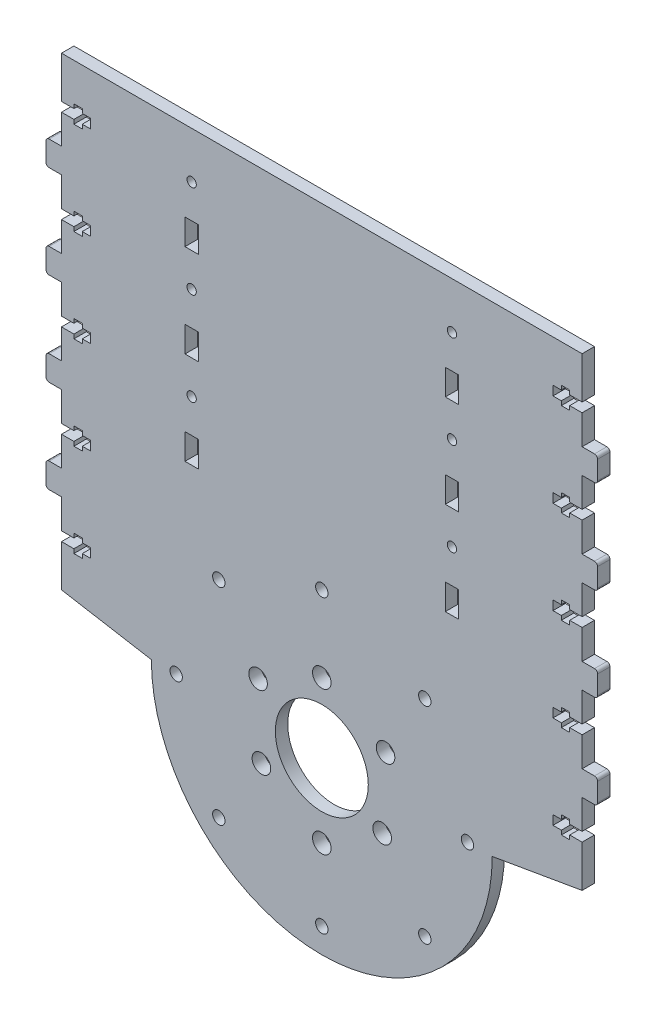
from build123d import *

# Parameters (mm, degrees)
SKETCH_1_R      = 1.5
SKETCH_1_R_2    = 3
SKETCH_1_R_3    = 15
SKETCH_1_R_4    = 2
SKETCH_1_W      = 4.3
SKETCH_1_H      = 8.3
EXTRUDE_1_DEPTH = 4
FILLET_1_R      = 1


with BuildPart() as part:
    # 草图1 → 凸台-拉伸1 (new body)
    with BuildSketch(Plane.XY):
        with BuildLine():
            Line((154.4, 46.5), (154.4, 49.5))
            Line((154.4, 49.5), (151.7, 49.5))
            Line((151.7, 49.5), (151.7, 50.85))
            Line((151.7, 50.85), (149, 50.85))
            Line((149, 50.85), (149, 49.5))
            Line((149, 49.5), (145, 49.5))
            Line((145, 49.5), (145, 59))
            Line((145, 59), (140, 59))
            Line((140, 59), (140, 67))
            Line((140, 67), (145, 67))
            Line((145, 67), (145, 76.5))
            Line((145, 76.5), (149, 76.5))
            Line((149, 76.5), (149, 75.15))
            Line((149, 75.15), (151.7, 75.15))
            Line((151.7, 75.15), (151.7, 76.5))
            Line((151.7, 76.5), (154.4, 76.5))
            Line((154.4, 76.5), (154.4, 79.5))
            Line((154.4, 79.5), (151.7, 79.5))
            Line((151.7, 79.5), (151.7, 80.85))
            Line((151.7, 80.85), (149, 80.85))
            Line((149, 80.85), (149, 79.5))
            Line((149, 79.5), (145, 79.5))
            Line((145, 79.5), (145, 89))
            Line((145, 89), (140, 89))
            Line((140, 89), (140, 97))
            Line((140, 97), (145, 97))
            Line((145, 97), (145, 106.5))
            Line((145, 106.5), (149, 106.5))
            Line((149, 106.5), (149, 105.15))
            Line((149, 105.15), (151.7, 105.15))
            Line((151.7, 105.15), (151.7, 106.5))
            Line((151.7, 106.5), (154.4, 106.5))
            Line((154.4, 106.5), (154.4, 109.5))
            Line((154.4, 109.5), (151.7, 109.5))
            Line((151.7, 109.5), (151.7, 110.85))
            Line((151.7, 110.85), (149, 110.85))
            Line((149, 110.85), (149, 109.5))
            Line((149, 109.5), (145, 109.5))
            Line((145, 109.5), (145, 123))
            Line((145, 123), (313, 123))
            Line((313, 123), (313, 109.5))
            Line((313, 109.5), (309, 109.5))
            Line((309, 109.5), (309, 110.85))
            Line((309, 110.85), (306.3, 110.85))
            Line((306.3, 110.85), (306.3, 109.5))
            Line((306.3, 109.5), (303.6, 109.5))
            Line((303.6, 109.5), (303.6, 106.5))
            Line((303.6, 106.5), (306.3, 106.5))
            Line((306.3, 106.5), (306.3, 105.15))
            Line((306.3, 105.15), (309, 105.15))
            Line((309, 105.15), (309, 106.5))
            Line((309, 106.5), (313, 106.5))
            Line((313, 106.5), (313, 97))
            Line((313, 97), (318, 97))
            Line((318, 97), (318, 89))
            Line((318, 89), (313, 89))
            Line((313, 89), (313, 79.5))
            Line((313, 79.5), (309, 79.5))
            Line((309, 79.5), (309, 80.85))
            Line((309, 80.85), (306.3, 80.85))
            Line((306.3, 80.85), (306.3, 79.5))
            Line((306.3, 79.5), (303.6, 79.5))
            Line((303.6, 79.5), (303.6, 76.5))
            Line((303.6, 76.5), (306.3, 76.5))
            Line((306.3, 76.5), (306.3, 75.15))
            Line((306.3, 75.15), (309, 75.15))
            Line((309, 75.15), (309, 76.5))
            Line((309, 76.5), (313, 76.5))
            Line((313, 76.5), (313, 67))
            Line((313, 67), (318, 67))
            Line((318, 67), (318, 59))
            Line((318, 59), (313, 59))
            Line((313, 59), (313, 49.5))
            Line((313, 49.5), (309, 49.5))
            Line((309, 49.5), (309, 50.85))
            Line((309, 50.85), (306.3, 50.85))
            Line((306.3, 50.85), (306.3, 49.5))
            Line((306.3, 49.5), (303.6, 49.5))
            Line((303.6, 49.5), (303.6, 46.5))
            Line((303.6, 46.5), (306.3, 46.5))
            Line((306.3, 46.5), (306.3, 45.15))
            Line((306.3, 45.15), (309, 45.15))
            Line((309, 45.15), (309, 46.5))
            Line((309, 46.5), (313, 46.5))
            Line((313, 46.5), (313, 37))
            Line((313, 37), (318, 37))
            Line((318, 37), (318, 29))
            Line((318, 29), (313, 29))
            Line((313, 29), (313, 19.5))
            Line((313, 19.5), (309, 19.5))
            Line((309, 19.5), (309, 20.85))
            Line((309, 20.85), (306.3, 20.85))
            Line((306.3, 20.85), (306.3, 19.5))
            Line((306.3, 19.5), (303.6, 19.5))
            Line((303.6, 19.5), (303.6, 16.5))
            Line((303.6, 16.5), (306.3, 16.5))
            Line((306.3, 16.5), (306.3, 15.15))
            Line((306.3, 15.15), (309, 15.15))
            Line((309, 15.15), (309, 16.5))
            Line((309, 16.5), (313, 16.5))
            Line((313, 16.5), (313, 7))
            Line((313, 7), (318, 7))
            Line((318, 7), (318, -1))
            Line((318, -1), (313, -1))
            Line((313, -1), (313, -10.5))
            Line((313, -10.5), (309, -10.5))
            Line((309, -10.5), (309, -9.15))
            Line((309, -9.15), (306.3, -9.15))
            Line((306.3, -9.15), (306.3, -10.5))
            Line((306.3, -10.5), (303.6, -10.5))
            Line((303.6, -10.5), (303.6, -13.5))
            Line((303.6, -13.5), (306.3, -13.5))
            Line((306.3, -13.5), (306.3, -14.85))
            Line((306.3, -14.85), (309, -14.85))
            Line((309, -14.85), (309, -13.5))
            Line((309, -13.5), (313, -13.5))
            Line((313, -13.5), (313, -27))
            Line((313, -27), (284, -32))
            ThreePointArc((284, -32), (229, -87), (174, -32))
            Line((174, -32), (145, -27))
            Line((145, -27), (145, -13.5))
            Line((145, -13.5), (149, -13.5))
            Line((149, -13.5), (149, -14.85))
            Line((149, -14.85), (151.7, -14.85))
            Line((151.7, -14.85), (151.7, -13.5))
            Line((151.7, -13.5), (154.4, -13.5))
            Line((154.4, -13.5), (154.4, -10.5))
            Line((154.4, -10.5), (151.7, -10.5))
            Line((151.7, -10.5), (151.7, -9.15))
            Line((151.7, -9.15), (149, -9.15))
            Line((149, -9.15), (149, -10.5))
            Line((149, -10.5), (145, -10.5))
            Line((145, -10.5), (145, -1))
            Line((145, -1), (140, -1))
            Line((140, -1), (140, 7))
            Line((140, 7), (145, 7))
            Line((145, 7), (145, 16.5))
            Line((145, 16.5), (149, 16.5))
            Line((149, 16.5), (149, 15.15))
            Line((149, 15.15), (151.7, 15.15))
            Line((151.7, 15.15), (151.7, 16.5))
            Line((151.7, 16.5), (154.4, 16.5))
            Line((154.4, 16.5), (154.4, 19.5))
            Line((154.4, 19.5), (151.7, 19.5))
            Line((151.7, 19.5), (151.7, 20.85))
            Line((151.7, 20.85), (149, 20.85))
            Line((149, 20.85), (149, 19.5))
            Line((149, 19.5), (145, 19.5))
            Line((145, 19.5), (145, 29))
            Line((145, 29), (140, 29))
            Line((140, 29), (140, 37))
            Line((140, 37), (145, 37))
            Line((145, 37), (145, 46.5))
            Line((145, 46.5), (149, 46.5))
            Line((149, 46.5), (149, 45.15))
            Line((149, 45.15), (151.7, 45.15))
            Line((151.7, 45.15), (151.7, 46.5))
            Line((151.7, 46.5), (154.4, 46.5))
        make_face()
        with Locations((187, 108)):
            Circle(SKETCH_1_R, mode=Mode.SUBTRACT)
        with Locations((229, -55.75)):
            Circle(SKETCH_1_R_2, mode=Mode.SUBTRACT)
        with Locations((248.485571585, -43.25)):
            Circle(SKETCH_1_R_2, mode=Mode.SUBTRACT)
        with Locations((229, -32)):
            Circle(SKETCH_1_R_3, mode=Mode.SUBTRACT)
        with Locations((276, -32)):
            Circle(SKETCH_1_R_4, mode=Mode.SUBTRACT)
        with Locations((208.43189666, -20.125)):
            Circle(SKETCH_1_R_2, mode=Mode.SUBTRACT)
        with Locations((249.56810334, -20.125)):
            Circle(SKETCH_1_R_2, mode=Mode.SUBTRACT)
        with Locations((209.514428415, -43.25)):
            Circle(SKETCH_1_R_2, mode=Mode.SUBTRACT)
        with Locations((229, -9.5)):
            Circle(SKETCH_1_R_2, mode=Mode.SUBTRACT)
        with Locations((187, 78)):
            Circle(SKETCH_1_R, mode=Mode.SUBTRACT)
        with Locations((187, 48)):
            Circle(SKETCH_1_R, mode=Mode.SUBTRACT)
        with Locations((271, 48)):
            Circle(SKETCH_1_R, mode=Mode.SUBTRACT)
        with Locations((271, 78)):
            Circle(SKETCH_1_R, mode=Mode.SUBTRACT)
        with Locations((271, 108)):
            Circle(SKETCH_1_R, mode=Mode.SUBTRACT)
        with Locations((262.234018716, -65.234018716)):
            Circle(SKETCH_1_R_4, mode=Mode.SUBTRACT)
        with Locations((229, -79)):
            Circle(SKETCH_1_R_4, mode=Mode.SUBTRACT)
        with Locations((195.765981284, -65.234018716)):
            Circle(SKETCH_1_R_4, mode=Mode.SUBTRACT)
        with Locations((182, -32)):
            Circle(SKETCH_1_R_4, mode=Mode.SUBTRACT)
        with Locations((195.765981284, 1.234018716)):
            Circle(SKETCH_1_R_4, mode=Mode.SUBTRACT)
        with Locations((229, 15)):
            Circle(SKETCH_1_R_4, mode=Mode.SUBTRACT)
        with Locations((262.234018716, 1.234018716)):
            Circle(SKETCH_1_R_4, mode=Mode.SUBTRACT)
        with Locations((187, 93)):
            Rectangle(SKETCH_1_W, SKETCH_1_H, mode=Mode.SUBTRACT)
        with Locations((187, 63)):
            Rectangle(SKETCH_1_W, SKETCH_1_H, mode=Mode.SUBTRACT)
        with Locations((271, 63)):
            Rectangle(SKETCH_1_W, SKETCH_1_H, mode=Mode.SUBTRACT)
        with Locations((271, 93)):
            Rectangle(SKETCH_1_W, SKETCH_1_H, mode=Mode.SUBTRACT)
        with Locations((187, 33)):
            Rectangle(SKETCH_1_W, SKETCH_1_H, mode=Mode.SUBTRACT)
        with Locations((271, 33)):
            Rectangle(SKETCH_1_W, SKETCH_1_H, mode=Mode.SUBTRACT)
    extrude(amount=EXTRUDE_1_DEPTH)

    # 圆角1
    fillet_1_edges = [part.edges().sort_by_distance(p)[0] for p in [
        (140, -1, 2),
        (140, 7, 2),
        (140, 29, 2),
        (140, 37, 2),
        (140, 59, 2),
        (140, 67, 2),
        (140, 89, 2),
        (140, 97, 2),
        (318, 97, 2),
        (318, 89, 2),
        (318, 67, 2),
        (318, 59, 2),
        (318, 37, 2),
        (318, 29, 2),
        (318, 7, 2),
        (318, -1, 2),
    ]]
    fillet(fillet_1_edges, radius=FILLET_1_R)


solid = part.part
